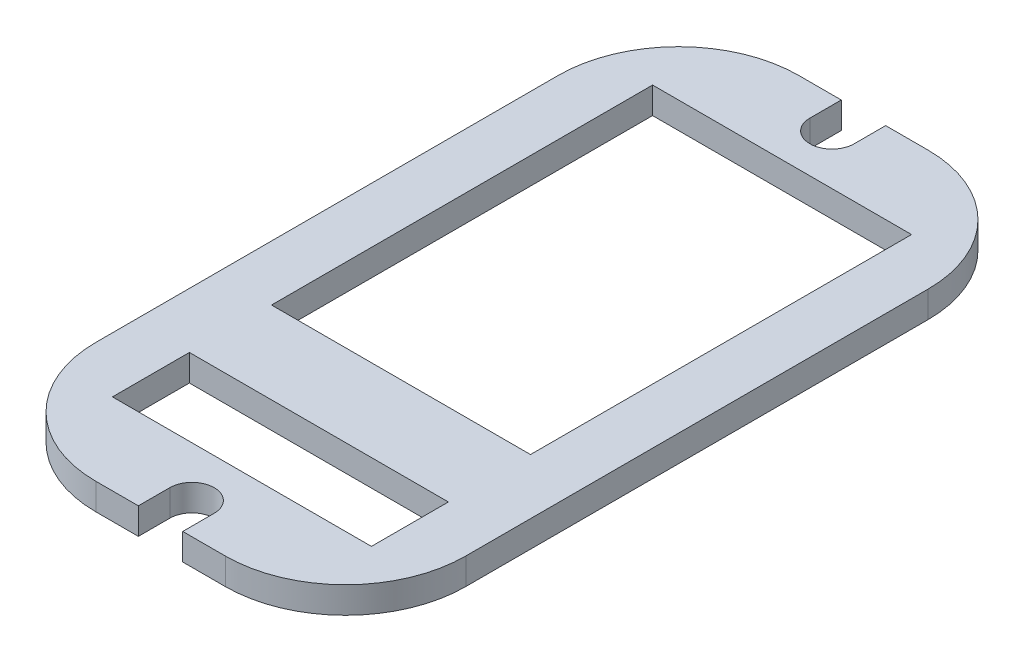
from build123d import *

# Parameters (mm, degrees)
SKETCH2_W           = 7
SKETCH2_H           = 10.3
SKETCH2_H_2         = 2.08
BOSS_EXTRUDE1_DEPTH = 0.716


with BuildPart() as part:
    # Sketch2 → Boss-Extrude1 (new body)
    with BuildSketch(Plane(origin=(0, 0, 0), x_dir=(1, 0, 0), z_dir=(0, 1, 0))):
        with BuildLine():
            Line((-0.6, 9.5), (-1.75, 9.5))
            ThreePointArc((-1.75, 9.5), (-4.048097039, 8.548097039), (-5, 6.25))
            Line((-5, 6.25), (-5, -6.25))
            ThreePointArc((-5, -6.25), (-4.048097039, -8.548097039), (-1.75, -9.5))
            Line((-1.75, -9.5), (-0.6, -9.5))
            Line((-0.6, -9.5), (-0.6, -8.65))
            ThreePointArc((-0.6, -8.65), (0, -8.05), (0.6, -8.65))
            Line((0.6, -8.65), (0.6, -9.5))
            Line((0.6, -9.5), (1.75, -9.5))
            ThreePointArc((1.75, -9.5), (4.048097039, -8.548097039), (5, -6.25))
            Line((5, -6.25), (5, 6.25))
            ThreePointArc((5, 6.25), (4.048097039, 8.548097039), (1.75, 9.5))
            Line((1.75, 9.5), (0.6, 9.5))
            Line((0.6, 9.5), (0.6, 8.65))
            ThreePointArc((0.6, 8.65), (0, 8.05), (-0.6, 8.65))
            Line((-0.6, 8.65), (-0.6, 9.5))
        make_face()
        with Locations((0, 2.15)):
            Rectangle(SKETCH2_W, SKETCH2_H, mode=Mode.SUBTRACT)
        with Locations((0, -6.26)):
            Rectangle(SKETCH2_W, SKETCH2_H_2, mode=Mode.SUBTRACT)
    extrude(amount=BOSS_EXTRUDE1_DEPTH)


solid = part.part
